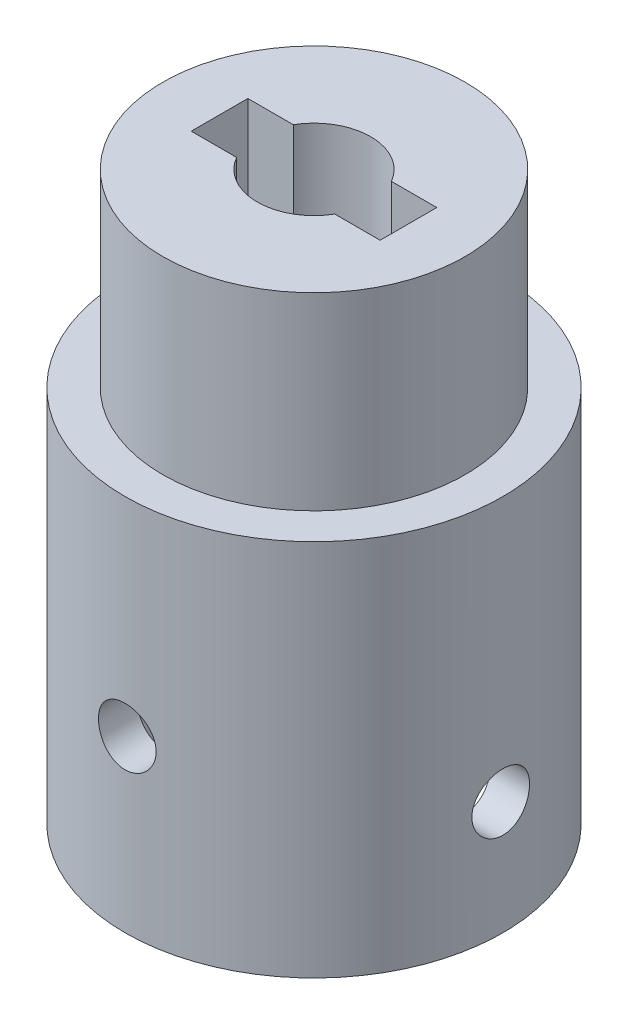
from build123d import *

# Parameters (mm, degrees)
SKETCH_8_R               = 16
EXTRUDE_3_DEPTH          = 20
SKETCH_8_4_R             = 20
EXTRUDE_4_DEPTH          = 40
CUT_EXTRUDE_6_REACH      = 120.709
CUT_EXTRUDE_7_DEPTH      = 110.963350072
CUT_EXTRUDE_7_DEPTH_BACK = 110.963350072
SKETCH_11_R              = 3.05
SKETCH_12_R              = 16.025
CUT_EXTRUDE_8_DEPTH      = 30
CUT_EXTRUDE_9_DEPTH      = 110.963350224
CUT_EXTRUDE_9_DEPTH_BACK = 110.963350224
SKETCH_14_R              = 3.05


with BuildPart() as part:
    # 草图8 → 凸台-拉伸3 (new body)
    with BuildSketch(Plane(origin=(0, 0, 0), x_dir=(1, 0, 0), z_dir=(0, 1, 0))):
        with Locations((79.639435379, -3.747026688)):
            Circle(SKETCH_8_R)
    extrude(amount=EXTRUDE_3_DEPTH)

    # 草图8<4> → 凸台-拉伸4 (add)
    with BuildSketch(Plane(origin=(0, 0, 0), x_dir=(1, 0, 0), z_dir=(0, 1, 0))):
        with Locations((79.639435379, -3.747026688)):
            Circle(SKETCH_8_4_R)
    extrude(amount=-EXTRUDE_4_DEPTH)

    # 草图10 → 切除-拉伸6 (cut, up to next)
    with BuildSketch(Plane(origin=(0, 20, 0), x_dir=(1, 0, 0), z_dir=(0, 1, 0)), mode=Mode.PRIVATE) as cut_extrude_6_sk1:
        with BuildLine():
            Line((84.835587801, -0.747026688), (89.639435379, -0.747026688))
            Line((89.639435379, -0.747026688), (89.639435379, -6.747026688))
            Line((89.639435379, -6.747026688), (84.835587801, -6.747026688))
            ThreePointArc((84.835587801, -6.747026688), (79.639435379, -9.747026688), (74.443282956, -6.747026688))
            Line((74.443282956, -6.747026688), (69.639435379, -6.747026688))
            Line((69.639435379, -6.747026688), (69.639435379, -0.747026688))
            Line((69.639435379, -0.747026688), (74.443282956, -0.747026688))
            ThreePointArc((74.443282956, -0.747026688), (79.639435379, 2.252973312), (84.835587801, -0.747026688))
        make_face()
    cut_extrude_6_tool1 = extrude(cut_extrude_6_sk1.sketch, amount=-CUT_EXTRUDE_6_REACH, mode=Mode.PRIVATE) & part.part
    add(cut_extrude_6_tool1.solids().sort_by_distance((79.639435, 20, 3.747027))[0], mode=Mode.SUBTRACT)

    # 草图11 → 切除-拉伸7 (cut, two sides: drawn at the far end of the back side and taken through both)
    with BuildSketch(Plane.XY.offset(-CUT_EXTRUDE_7_DEPTH_BACK)):
        with Locations((79.639435379, -22)):
            Circle(SKETCH_11_R)
    extrude(amount=CUT_EXTRUDE_7_DEPTH + CUT_EXTRUDE_7_DEPTH_BACK, mode=Mode.SUBTRACT)

    # 草图12 → 切除-拉伸8 (cut)
    with BuildSketch(Plane.XZ.offset(40)):
        with Locations((79.639435379, 3.747026688)):
            Circle(SKETCH_12_R)
    extrude(amount=-CUT_EXTRUDE_8_DEPTH, mode=Mode.SUBTRACT)

    # 草图14 → 切除-拉伸9 (cut, two sides: drawn at the far end of the back side and taken through both)
    with BuildSketch(Plane.YZ.offset(-CUT_EXTRUDE_9_DEPTH_BACK)):
        with Locations((-28, 3.747026688)):
            Circle(SKETCH_14_R)
    extrude(amount=CUT_EXTRUDE_9_DEPTH + CUT_EXTRUDE_9_DEPTH_BACK, mode=Mode.SUBTRACT)


solid = part.part
